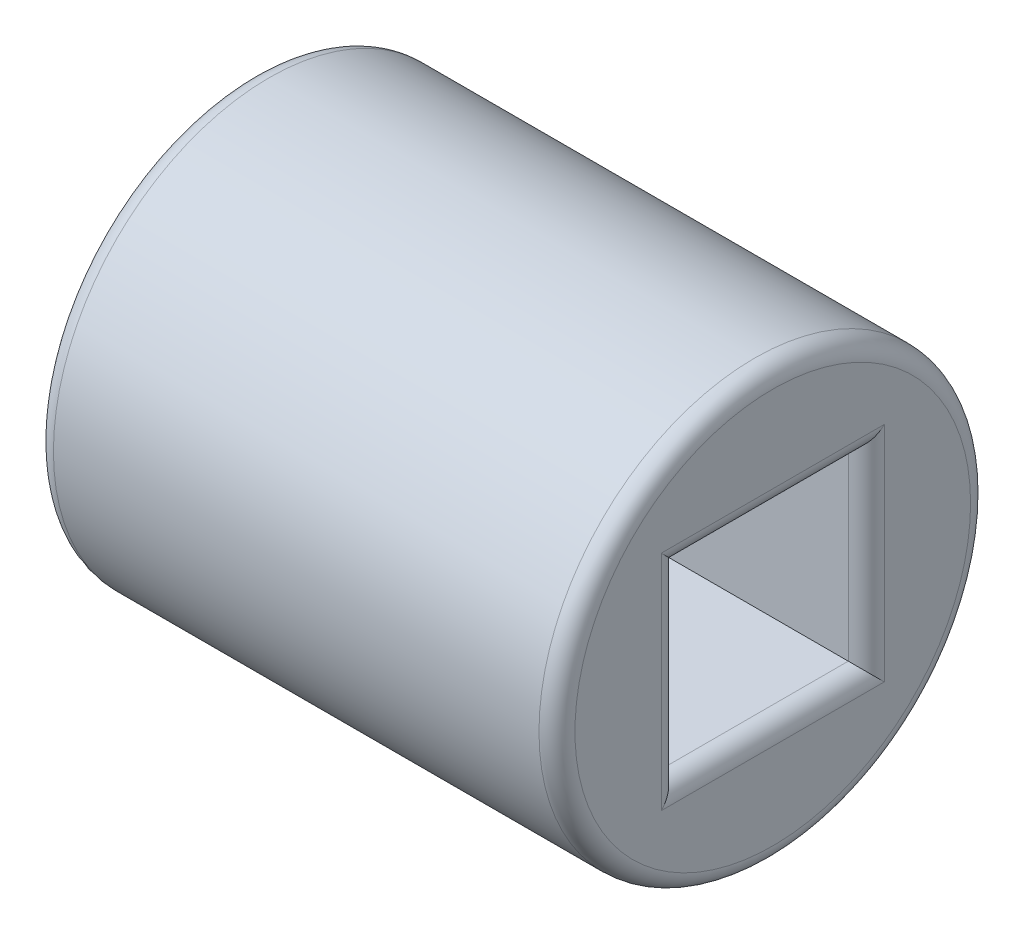
from build123d import *

# Parameters (mm, degrees)
SKETCH1_R           = 7.62
SKETCH1_W           = 6.604
SKETCH1_H           = 6.604
BOSS_EXTRUDE1_DEPTH = 18.415
FILLET1_R           = 0.635


with BuildPart() as part:
    # Sketch1 → Boss-Extrude1 (new body)
    with BuildSketch(Plane(origin=(0, 0, 0), x_dir=(0, 0, -1), z_dir=(1, 0, 0))):
        Circle(SKETCH1_R)
        Rectangle(SKETCH1_W, SKETCH1_H, mode=Mode.SUBTRACT)
    extrude(amount=BOSS_EXTRUDE1_DEPTH)

    # Fillet1
    fillet1_edges = [part.edges().sort_by_distance(p)[0] for p in [
        (18.415, 0, 3.302),
        (18.415, -3.302, 0),
        (0, 0, 7.62),
        (18.415, 0, 7.62),
        (0, 0, -3.302),
        (0, 3.302, 0),
        (0, 0, 3.302),
        (0, -3.302, 0),
        (18.415, 0, -3.302),
        (18.415, 3.302, 0),
    ]]
    fillet(fillet1_edges, radius=FILLET1_R)


solid = part.part
